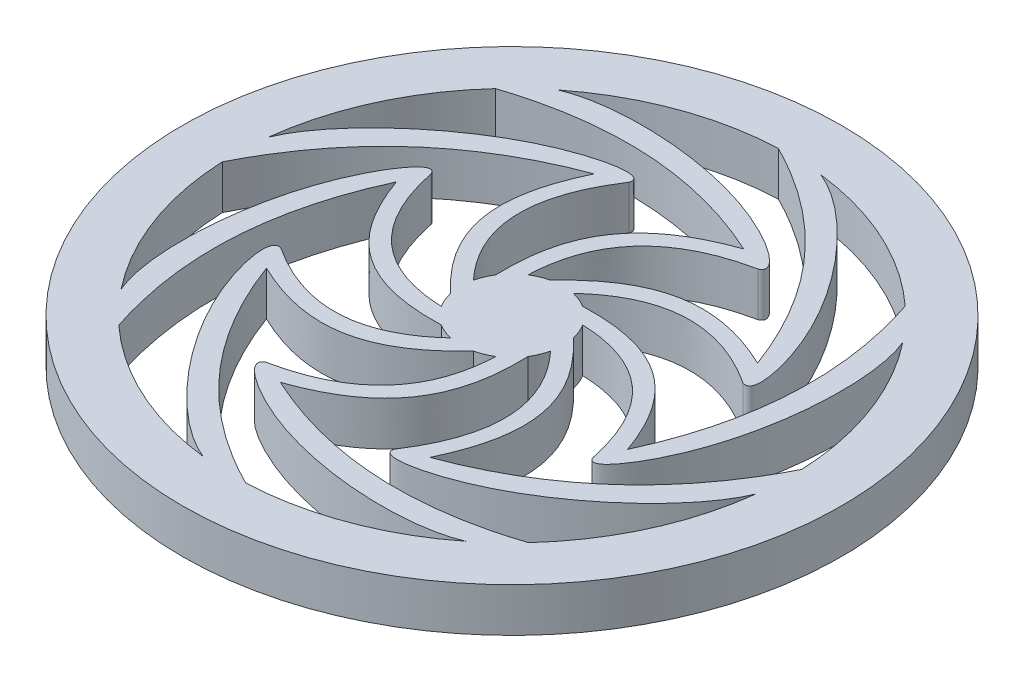
from build123d import *

# Parameters (mm, degrees)
SKETCH1_R           = 22.5
BOSS_EXTRUDE1_DEPTH = 3


with BuildPart() as part:
    # Sketch1 → Boss-Extrude1 (new body)
    with BuildSketch(Plane(origin=(0, 0, 0), x_dir=(1, 0, 0), z_dir=(0, 1, 0))):
        with Locations(Location((0, 0, 0), (0, 0, 270))):
            Circle(SKETCH1_R)
        with BuildLine():
            ThreePointArc((12.858274793, 13.988022353), (7.926678354, 17.267535154), (2.224901963, 18.869282214))
            add(Edge.make_bspline(
                [(11.875562109, 3.901413152), (12.889627473, 3.505325226), (11.613923706, 10.788790468), (5.151799162, 17.696017864), (2.224901963, 18.869282214)],
                knots=[0, 0, 0, 0, 0.363857402, 1, 1, 1, 1], degree=3))
            add(Edge.make_bspline(
                [(0.778823269, 3.412247693), (5.685303017, 7.967969249), (11.875562109, 3.901413152)],
                knots=[0, 0, 0, 1, 1, 1], degree=2))
            ThreePointArc((0.778823269, 3.412247693), (1.339392013, 3.233578364), (1.862112268, 2.963534697))
            add(Edge.make_bspline(
                [(1.862112268, 2.963534697), (7.080742295, 3.142252132), (10.068013486, 1.06766484), (11.854735792, -3.964245112)],
                knots=[0, 0, 0, 0, 1, 1, 1, 1], degree=3))
            add(Edge.make_bspline(
                [(11.854735792, -3.964245112), (15.892673154, 4.806059129), (12.858274793, 13.988022353)],
                knots=[0, 0, 0, 1, 1, 1], degree=2))
        make_face(mode=Mode.SUBTRACT)
        with BuildLine():
            ThreePointArc((0.778823269, -3.412247693), (1.339392013, -3.233578364), (1.862112268, -2.963534697))
            add(Edge.make_bspline(
                [(1.862112268, -2.963534697), (1.614088771, -9.654321405), (-5.638574802, -11.156006194)],
                knots=[0, 0, 0, 1, 1, 1], degree=2))
            add(Edge.make_bspline(
                [(-5.638574802, -11.156006194), (-6.635703756, -11.592982231), (-0.583457308, -15.84111111), (8.870102109, -16.155846354), (11.769354144, -14.915840675)],
                knots=[0, 0, 0, 0, 0.363857402, 1, 1, 1, 1], degree=3))
            ThreePointArc((11.769354144, -14.915840675), (6.604983185, -17.814999218), (0.79885216, -18.983198762))
            add(Edge.make_bspline(
                [(-11.185708668, -5.579419467), (-7.839419958, -14.63621396), (0.79885216, -18.983198762)],
                knots=[0, 0, 0, 1, 1, 1], degree=2))
            add(Edge.make_bspline(
                [(0.778823269, -3.412247693), (-2.784933102, -7.228748683), (-6.36420756, -7.874113658), (-11.185708668, -5.579419467)],
                knots=[0, 0, 0, 0, 1, 1, 1, 1], degree=3))
        make_face(mode=Mode.SUBTRACT)
        with BuildLine():
            ThreePointArc((-0.79885216, 18.983198762), (-6.604983185, 17.814999218), (-11.769354144, 14.915840675))
            add(Edge.make_bspline(
                [(5.638574802, 11.156006194), (6.635703756, 11.592982231), (0.583457308, 15.84111111), (-8.870102109, 16.155846354), (-11.769354144, 14.915840675)],
                knots=[0, 0, 0, 0, 0.363857402, 1, 1, 1, 1], degree=3))
            add(Edge.make_bspline(
                [(-1.862112268, 2.963534697), (-1.614088771, 9.654321405), (5.638574802, 11.156006194)],
                knots=[0, 0, 0, 1, 1, 1], degree=2))
            ThreePointArc((-1.862112268, 2.963534697), (-1.339392013, 3.233578364), (-0.778823269, 3.412247693))
            add(Edge.make_bspline(
                [(-0.778823269, 3.412247693), (2.784933102, 7.228748683), (6.36420756, 7.874113658), (11.185708668, 5.579419467)],
                knots=[0, 0, 0, 0, 1, 1, 1, 1], degree=3))
            add(Edge.make_bspline(
                [(11.185708668, 5.579419467), (7.839419958, 14.63621396), (-0.79885216, 18.983198762)],
                knots=[0, 0, 0, 1, 1, 1], degree=2))
        make_face(mode=Mode.SUBTRACT)
        with BuildLine():
            ThreePointArc((-13.988022353, 12.858274793), (-17.267535154, 7.926678354), (-18.869282214, 2.224901963))
            add(Edge.make_bspline(
                [(-3.901413152, 11.875562109), (-3.505325226, 12.889627473), (-10.788790468, 11.613923706), (-17.696017864, 5.151799162), (-18.869282214, 2.224901963)],
                knots=[0, 0, 0, 0, 0.363857402, 1, 1, 1, 1], degree=3))
            add(Edge.make_bspline(
                [(-3.412247693, 0.778823269), (-7.967969249, 5.685303017), (-3.901413152, 11.875562109)],
                knots=[0, 0, 0, 1, 1, 1], degree=2))
            ThreePointArc((-3.412247693, 0.778823269), (-3.233578364, 1.339392013), (-2.963534697, 1.862112268))
            add(Edge.make_bspline(
                [(-2.963534697, 1.862112268), (-3.142252132, 7.080742295), (-1.06766484, 10.068013486), (3.964245112, 11.854735792)],
                knots=[0, 0, 0, 0, 1, 1, 1, 1], degree=3))
            add(Edge.make_bspline(
                [(3.964245112, 11.854735792), (-4.806059129, 15.892673154), (-13.988022353, 12.858274793)],
                knots=[0, 0, 0, 1, 1, 1], degree=2))
        make_face(mode=Mode.SUBTRACT)
        with BuildLine():
            ThreePointArc((-18.983198762, -0.79885216), (-17.814999218, -6.604983185), (-14.915840675, -11.769354144))
            add(Edge.make_bspline(
                [(-11.156006194, 5.638574802), (-11.592982231, 6.635703756), (-15.84111111, 0.583457308), (-16.155846354, -8.870102109), (-14.915840675, -11.769354144)],
                knots=[0, 0, 0, 0, 0.363857402, 1, 1, 1, 1], degree=3))
            add(Edge.make_bspline(
                [(-2.963534697, -1.862112268), (-9.654321405, -1.614088771), (-11.156006194, 5.638574802)],
                knots=[0, 0, 0, 1, 1, 1], degree=2))
            ThreePointArc((-2.963534697, -1.862112268), (-3.233578364, -1.339392013), (-3.412247693, -0.778823269))
            add(Edge.make_bspline(
                [(-3.412247693, -0.778823269), (-7.228748683, 2.784933102), (-7.874113658, 6.36420756), (-5.579419467, 11.185708668)],
                knots=[0, 0, 0, 0, 1, 1, 1, 1], degree=3))
            add(Edge.make_bspline(
                [(-5.579419467, 11.185708668), (-14.63621396, 7.839419958), (-18.983198762, -0.79885216)],
                knots=[0, 0, 0, 1, 1, 1], degree=2))
        make_face(mode=Mode.SUBTRACT)
        with BuildLine():
            ThreePointArc((-12.858274793, -13.988022353), (-7.926678354, -17.267535154), (-2.224901963, -18.869282214))
            add(Edge.make_bspline(
                [(-11.875562109, -3.901413152), (-12.889627473, -3.505325226), (-11.613923706, -10.788790468), (-5.151799162, -17.696017864), (-2.224901963, -18.869282214)],
                knots=[0, 0, 0, 0, 0.363857402, 1, 1, 1, 1], degree=3))
            add(Edge.make_bspline(
                [(-0.778823269, -3.412247693), (-5.685303017, -7.967969249), (-11.875562109, -3.901413152)],
                knots=[0, 0, 0, 1, 1, 1], degree=2))
            ThreePointArc((-0.778823269, -3.412247693), (-1.339392013, -3.233578364), (-1.862112268, -2.963534697))
            add(Edge.make_bspline(
                [(-1.862112268, -2.963534697), (-7.080742295, -3.142252132), (-10.068013486, -1.06766484), (-11.854735792, 3.964245112)],
                knots=[0, 0, 0, 0, 1, 1, 1, 1], degree=3))
            add(Edge.make_bspline(
                [(-11.854735792, 3.964245112), (-15.892673154, -4.806059129), (-12.858274793, -13.988022353)],
                knots=[0, 0, 0, 1, 1, 1], degree=2))
        make_face(mode=Mode.SUBTRACT)
        with BuildLine():
            ThreePointArc((13.988022353, -12.858274793), (17.267535154, -7.926678354), (18.869282214, -2.224901963))
            add(Edge.make_bspline(
                [(3.901413152, -11.875562109), (3.505325226, -12.889627473), (10.788790468, -11.613923706), (17.696017864, -5.151799162), (18.869282214, -2.224901963)],
                knots=[0, 0, 0, 0, 0.363857402, 1, 1, 1, 1], degree=3))
            add(Edge.make_bspline(
                [(3.412247693, -0.778823269), (7.967969249, -5.685303017), (3.901413152, -11.875562109)],
                knots=[0, 0, 0, 1, 1, 1], degree=2))
            ThreePointArc((3.412247693, -0.778823269), (3.233578364, -1.339392013), (2.963534697, -1.862112268))
            add(Edge.make_bspline(
                [(2.963534697, -1.862112268), (3.142252132, -7.080742295), (1.06766484, -10.068013486), (-3.964245112, -11.854735792)],
                knots=[0, 0, 0, 0, 1, 1, 1, 1], degree=3))
            add(Edge.make_bspline(
                [(-3.964245112, -11.854735792), (4.806059129, -15.892673154), (13.988022353, -12.858274793)],
                knots=[0, 0, 0, 1, 1, 1], degree=2))
        make_face(mode=Mode.SUBTRACT)
        with BuildLine():
            ThreePointArc((3.412247693, 0.778823269), (3.233578364, 1.339392013), (2.963534697, 1.862112268))
            add(Edge.make_bspline(
                [(2.963534697, 1.862112268), (9.654321405, 1.614088771), (11.156006194, -5.638574802)],
                knots=[0, 0, 0, 1, 1, 1], degree=2))
            add(Edge.make_bspline(
                [(11.156006194, -5.638574802), (11.592982231, -6.635703756), (15.84111111, -0.583457308), (16.155846354, 8.870102109), (14.915840675, 11.769354144)],
                knots=[0, 0, 0, 0, 0.363857402, 1, 1, 1, 1], degree=3))
            ThreePointArc((14.915840675, 11.769354144), (17.814999218, 6.604983185), (18.983198762, 0.79885216))
            add(Edge.make_bspline(
                [(5.579419467, -11.185708668), (14.63621396, -7.839419958), (18.983198762, 0.79885216)],
                knots=[0, 0, 0, 1, 1, 1], degree=2))
            add(Edge.make_bspline(
                [(3.412247693, 0.778823269), (7.228748683, -2.784933102), (7.874113658, -6.36420756), (5.579419467, -11.185708668)],
                knots=[0, 0, 0, 0, 1, 1, 1, 1], degree=3))
        make_face(mode=Mode.SUBTRACT)
    extrude(amount=BOSS_EXTRUDE1_DEPTH)


solid = part.part
